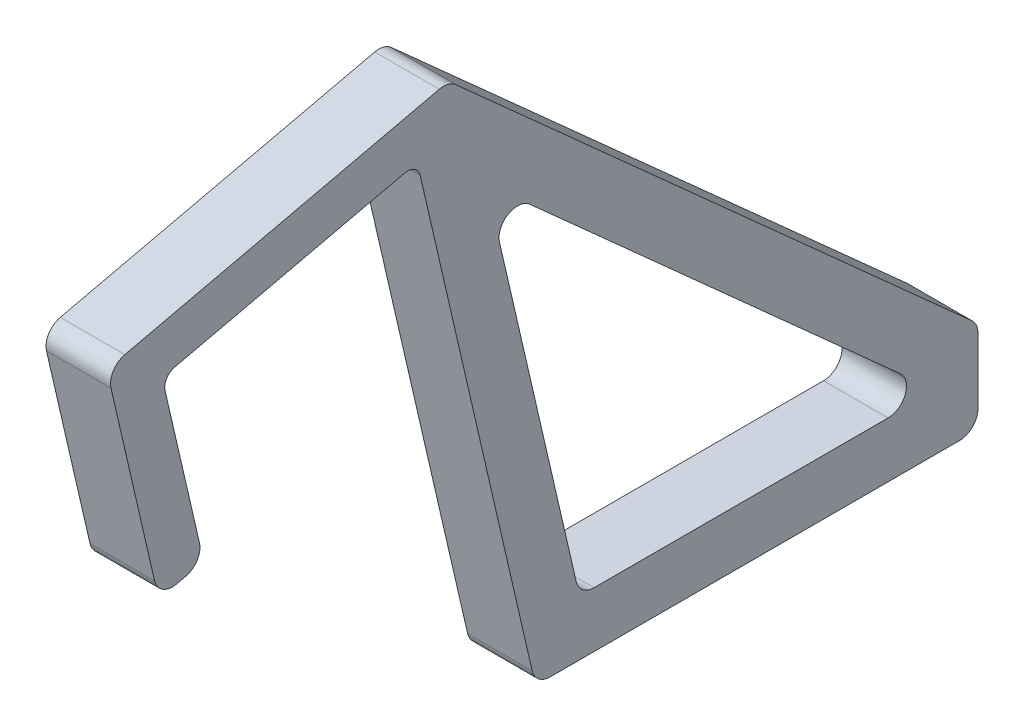
from build123d import *

# Parameters (mm, degrees)
BOSS_EXTRUDE1_DEPTH = 4.445
BOSS_EXTRUDE2_DEPTH = 4.445
FILLET1_R           = 0.889
FILLET2_R           = 1.27
CUT_EXTRUDE1_DEPTH  = 50.624972926
FILLET3_R           = 1.27


with BuildPart() as part:
    # Sketch1 → Boss-Extrude1 (new body)
    with BuildSketch(Plane(origin=(0, 0, 0), x_dir=(0, 0, -1), z_dir=(1, 0, 0))):
        Polygon((0, 0), (30.48, 0), (30.48, 6.35), (-1.792103412, 35.267324495), (-8.142103412, 35.267324495), align=None)
    extrude(amount=BOSS_EXTRUDE1_DEPTH)

    # Sketch2 → Boss-Extrude2 (add)
    with BuildSketch(Plane(origin=(4.445, 0, 0), x_dir=(0, 0, -1), z_dir=(1, 0, 0))):
        Polygon((-8.142103412, 35.267324495), (-25.71389316, 31.210557181), (-22.85701477, 18.836057358), (-25.950639726, 18.121837761), (-29.521737714, 33.589962539), (-5.984546816, 39.023951226), (-1.792103412, 35.267324495), align=None)
    extrude(amount=-BOSS_EXTRUDE2_DEPTH)

    # Fillet1
    fillet1_edges = [part.edges().sort_by_distance(p)[0] for p in [
        (2.2225, 31.210557181, 25.71389316),
        (2.2225, 35.267324495, 8.142103412),
    ]]
    fillet(fillet1_edges, radius=FILLET1_R)

    # Fillet2
    fillet2_edges = [part.edges().sort_by_distance(p)[0] for p in [
        (2.2225, 39.023951226, 5.984546816),
        (2.2225, 33.589962539, 29.521737714),
        (2.2225, 18.121837761, 25.950639726),
        (2.2225, 18.836057358, 22.85701477),
        (2.2225, 6.35, -30.48),
        (2.2225, 0, -30.48),
        (2.2225, 0, 0),
    ]]
    fillet(fillet2_edges, radius=FILLET2_R)

    # Sketch3 → Cut-Extrude1 (cut, through all)
    with BuildSketch(Plane(origin=(4.445, 0, 0), x_dir=(0, 0, -1), z_dir=(1, 0, 0))):
        Polygon((-3.37912104, 31.57359901), (3.030610843, 3.81), (27.605409997, 3.81), align=None)
    extrude(amount=-CUT_EXTRUDE1_DEPTH, mode=Mode.SUBTRACT)

    # Fillet3
    fillet3_edges = [part.edges().sort_by_distance(p)[0] for p in [
        (2.2225, 31.57359901, 3.37912104),
        (2.2225, 3.81, -27.605409997),
        (2.2225, 3.81, -3.030610843),
    ]]
    fillet(fillet3_edges, radius=FILLET3_R)


solid = part.part
